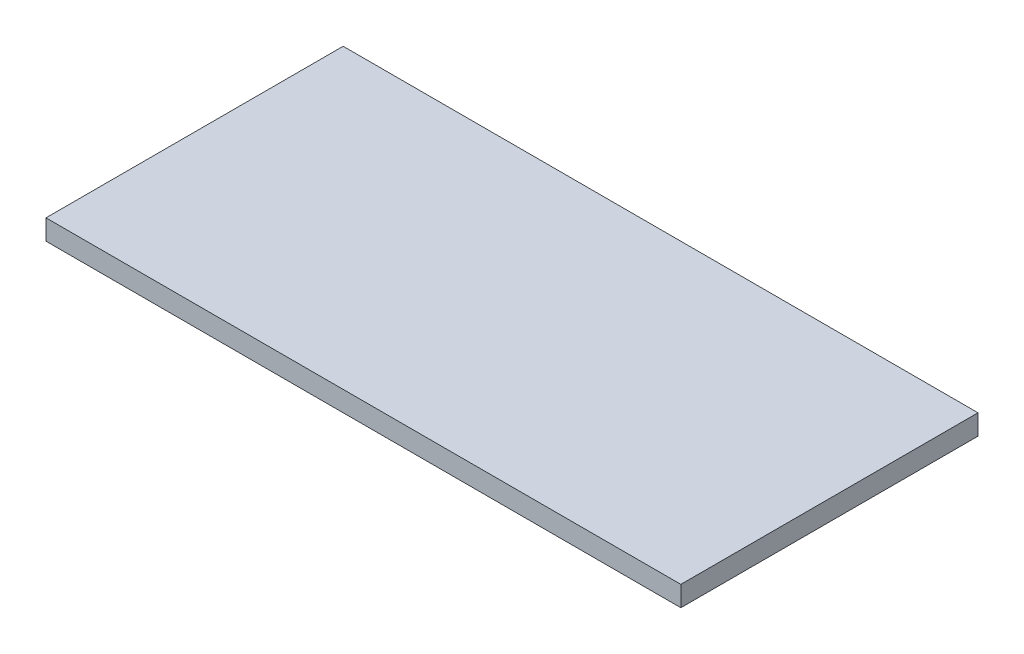
from build123d import *

# Parameters (mm, degrees)
SKETCH1_W           = 188
SKETCH1_H           = 88
BOSS_EXTRUDE1_DEPTH = 6


with BuildPart() as part:
    # Sketch1 → Boss-Extrude1 (new body)
    with BuildSketch(Plane(origin=(0, 0, 0), x_dir=(1, 0, 0), z_dir=(0, 1, 0))):
        with Locations((94, 44)):
            Rectangle(SKETCH1_W, SKETCH1_H)
    extrude(amount=BOSS_EXTRUDE1_DEPTH)


solid = part.part
